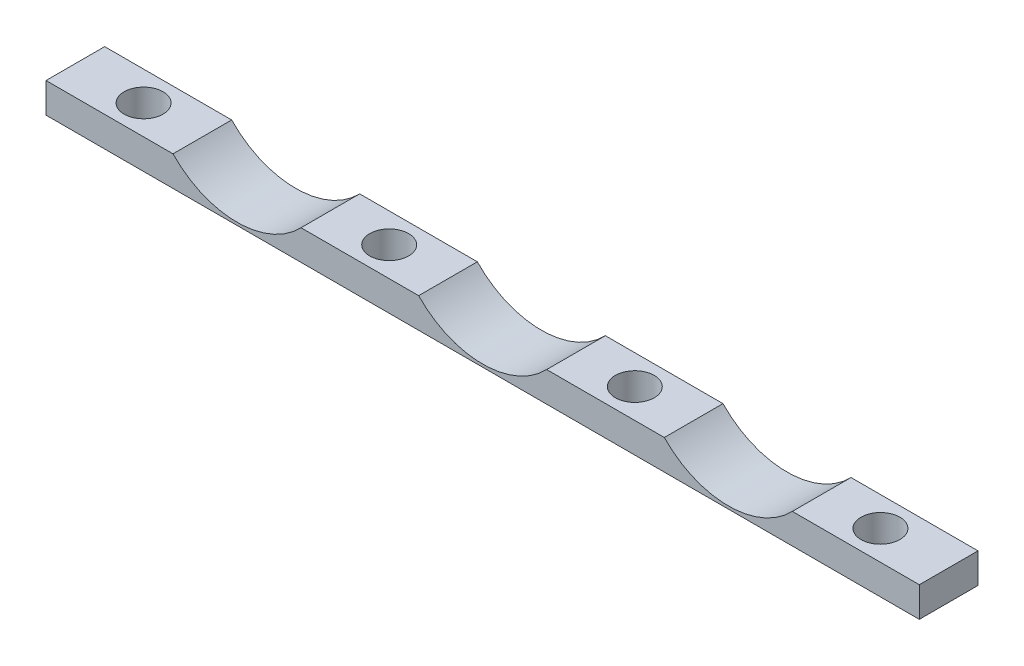
from build123d import *

# Parameters (mm, degrees)
BOSS_EXTRUDE1_DEPTH = 4.3
SKETCH2_R           = 1.425
CUT_EXTRUDE1_DEPTH  = 33.362478273


with BuildPart() as part:
    # Sketch1 → Boss-Extrude1 (new body)
    with BuildSketch(Plane.XY):
        with BuildLine():
            Line((-13.312338898, -10.5), (-4.69041576, -10.5))
            ThreePointArc((-4.69041576, -10.5), (0, -12.5), (4.69041576, -10.5))
            Line((4.69041576, -10.5), (13.312338898, -10.5))
            ThreePointArc((13.312338898, -10.5), (18.002754658, -12.5), (22.693170418, -10.5))
            Line((22.693170418, -10.5), (32, -10.5))
            Line((32, -10.5), (32, -12.7))
            Line((32, -12.7), (-32, -12.7))
            Line((-32, -12.7), (-32, -10.5))
            Line((-32, -10.5), (-22.693170418, -10.5))
            ThreePointArc((-22.693170418, -10.5), (-18.002754658, -12.5), (-13.312338898, -10.5))
        make_face()
    extrude(amount=BOSS_EXTRUDE1_DEPTH)

    # Sketch2 → Cut-Extrude1 (cut, through all)
    with BuildSketch(Plane(origin=(0, -10.5, 0), x_dir=(1, 0, 0), z_dir=(0, 1, 0))):
        with Locations(Location((-9, -2.15, 0), (0, 0, 180))):
            Circle(SKETCH2_R)
        with Locations(Location((9, -2.15, 0), (0, 0, 180))):
            Circle(SKETCH2_R)
        with Locations(Location((-27, -2.15, 0), (0, 0, 180))):
            Circle(SKETCH2_R)
        with Locations(Location((27, -2.15, 0), (0, 0, 180))):
            Circle(SKETCH2_R)
    extrude(amount=-CUT_EXTRUDE1_DEPTH, mode=Mode.SUBTRACT)


solid = part.part
